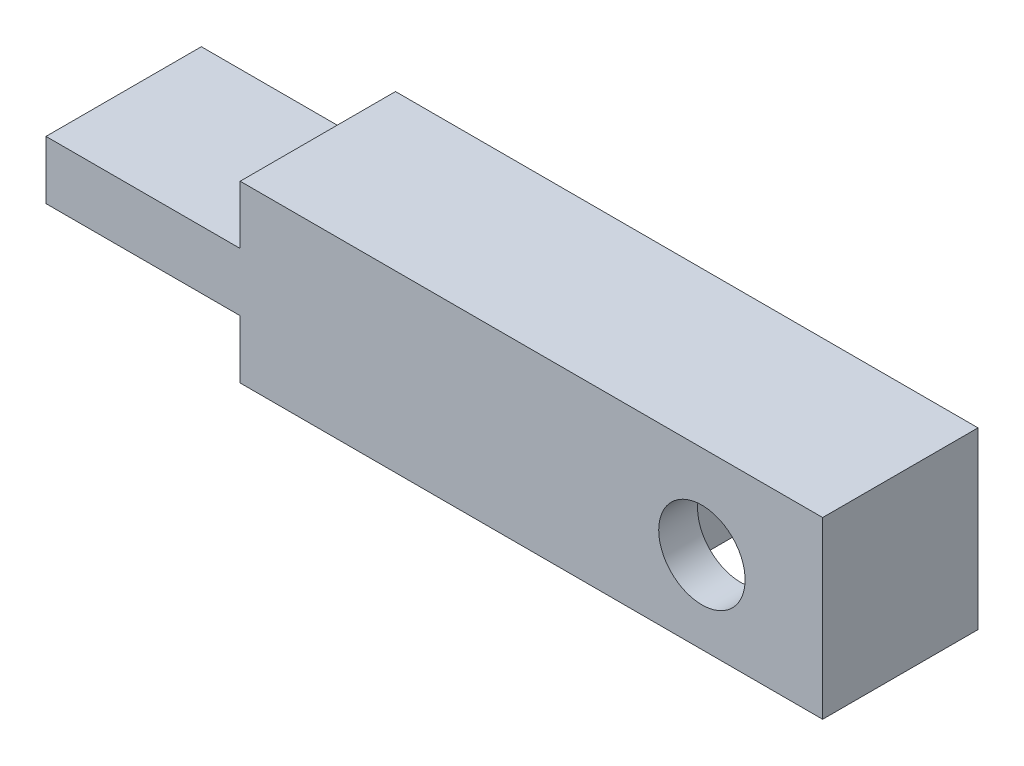
from build123d import *

# Parameters (mm, degrees)
CROQUIS1_W              = 350
CROQUIS1_H              = 40
SALIENTE_EXTRUIR1_DEPTH = 45
CROQUIS2_W              = 42.2
CROQUIS2_H              = 42.2
CORTAR_EXTRUIR1_DEPTH   = 30
CROQUIS3_R              = 11.125
CORTAR_EXTRUIR2_DEPTH   = 30
CROQUIS4_R              = 11.125
CORTAR_EXTRUIR4_DEPTH   = 186.067555233


with BuildPart() as part:
    # Croquis1 → Saliente-Extruir1 (new body)
    with BuildSketch(Plane(origin=(0, 0, 0), x_dir=(1, 0, 0), z_dir=(0, 1, 0))):
        Rectangle(CROQUIS1_W, CROQUIS1_H)
    extrude(amount=SALIENTE_EXTRUIR1_DEPTH)

    # Croquis2 → Cortar-Extruir1 (cut)
    with BuildSketch(Plane(origin=(0, 0, -20), x_dir=(-1, 0, 0), z_dir=(0, 0, -1))):
        with Locations((-143.9, 21.1)):
            Rectangle(CROQUIS2_W, CROQUIS2_H)
    cortar_extruir1 = extrude(amount=-CORTAR_EXTRUIR1_DEPTH, mode=Mode.SUBTRACT)

    # Croquis3 → Cortar-Extruir2 (cut)
    with BuildSketch(Plane(origin=(0, 0, 10), x_dir=(-1, 0, 0), z_dir=(0, 0, -1))):
        with Locations((-143.9, 21.1)):
            Circle(CROQUIS3_R)
    cortar_extruir2 = extrude(amount=-CORTAR_EXTRUIR2_DEPTH, mode=Mode.SUBTRACT)

    # Simetría1: Cortar-Extruir1, Cortar-Extruir2 across plane
    add(cortar_extruir1.mirror(Plane(origin=(0, 0, 0), x_dir=(0, 0, 1), z_dir=(1, 0, 0))), mode=Mode.SUBTRACT)
    add(cortar_extruir2.mirror(Plane(origin=(0, 0, 0), x_dir=(0, 0, 1), z_dir=(1, 0, 0))), mode=Mode.SUBTRACT)

    # Croquis4 → Cortar-Extruir4 (cut, through all)
    with BuildSketch(Plane.XY.offset(20)):
        Polygon((-175, 0), (25, 0), (25, 15), (-25, 15), (-25, 30), (25, 30), (25, 45), (-175, 45), align=None)
        with Locations((-143.9, 21.1)):
            Circle(CROQUIS4_R, mode=Mode.SUBTRACT)
    extrude(amount=-CORTAR_EXTRUIR4_DEPTH, mode=Mode.SUBTRACT)


solid = part.part
